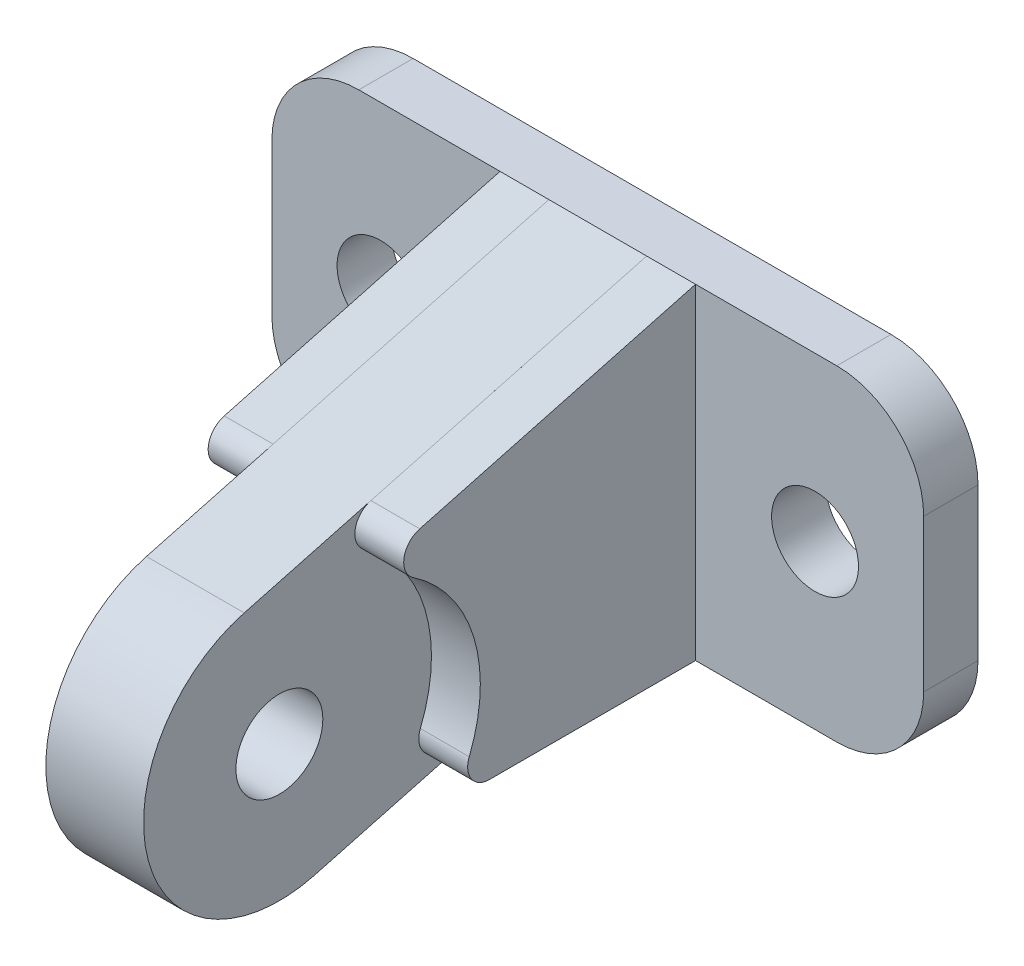
from build123d import *

# Parameters (mm, degrees)
SKETCH1_R                = 4
BOSS_EXTRUDE1_DEPTH      = 5
BOSS_EXTRUDE2_DEPTH      = 9
BOSS_EXTRUDE2_DEPTH_BACK = 9
BOSS_EXTRUDE3_DEPTH      = 4.5
BOSS_EXTRUDE3_DEPTH_BACK = 4.5
SKETCH3_3_R              = 4


with BuildPart() as part:
    # Sketch1 → Boss-Extrude1 (new body)
    with BuildSketch(Plane.XY):
        with BuildLine():
            ThreePointArc((-30, -7), (-27.656854249, -12.656854249), (-22, -15))
            Line((-22, -15), (22, -15))
            ThreePointArc((22, -15), (27.656854249, -12.656854249), (30, -7))
            Line((30, -7), (30, 7))
            ThreePointArc((30, 7), (27.656854249, 12.656854249), (22, 15))
            Line((22, 15), (-22, 15))
            ThreePointArc((-22, 15), (-27.656854249, 12.656854249), (-30, 7))
            Line((-30, 7), (-30, -7))
        make_face()
        with Locations((-20, 0)):
            Circle(SKETCH1_R, mode=Mode.SUBTRACT)
        with Locations((20, 0)):
            Circle(SKETCH1_R, mode=Mode.SUBTRACT)
    extrude(amount=BOSS_EXTRUDE1_DEPTH)

    # Sketch3 → Boss-Extrude2 (add, two sides: drawn at the far end of the back side and taken through both)
    with BuildSketch(Plane(origin=(0, 0, 0), x_dir=(0, 0, -1), z_dir=(1, 0, 0)).offset(-BOSS_EXTRUDE2_DEPTH_BACK)):
        with BuildLine():
            Line((-5, -15), (-5, 15))
            Line((-5, 15), (-30.384833832, 8.198154275))
            ThreePointArc((-30.384833832, 8.198154275), (-31.839798327, 6.596210245), (-30.985266169, 4.608014794))
            ThreePointArc((-30.985266169, 4.608014794), (-25.423013471, -2.908363546), (-25.833411807, -12.25))
            ThreePointArc((-25.833411807, -12.25), (-25.637674581, -14.118033989), (-23.979362186, -15))
            Line((-23.979362186, -15), (-20.371874306, -15))
            Line((-20.371874306, -15), (-5, -15))
        make_face()
    extrude(amount=BOSS_EXTRUDE2_DEPTH + BOSS_EXTRUDE2_DEPTH_BACK)

    # Sketch3<3> → Boss-Extrude3 (add, two sides: drawn at the far end of the back side and taken through both)
    with BuildSketch(Plane(origin=(0, 0, 0), x_dir=(0, 0, -1), z_dir=(1, 0, 0)).offset(-BOSS_EXTRUDE3_DEPTH_BACK)):
        with BuildLine():
            Line((-30.384833832, 8.198154275), (-5, 15))
            Line((-5, 15), (-42.04675827, 5.074136854))
            ThreePointArc((-42.04675827, 5.074136854), (-50.885864002, -10.235118587), (-35.576521096, -19.074072829))
            Line((-35.576521096, -19.074072829), (-20.371874306, -15))
            Line((-20.371874306, -15), (-23.979362186, -15))
            ThreePointArc((-23.979362186, -15), (-25.637674581, -14.118033989), (-25.833411807, -12.25))
            ThreePointArc((-25.833411807, -12.25), (-25.423013471, -2.908363546), (-30.985266169, 4.608014794))
            ThreePointArc((-30.985266169, 4.608014794), (-31.839798327, 6.596210245), (-30.384833832, 8.198154275))
        make_face()
        with Locations((-38.81175916, -7)):
            Circle(SKETCH3_3_R, mode=Mode.SUBTRACT)
    extrude(amount=BOSS_EXTRUDE3_DEPTH + BOSS_EXTRUDE3_DEPTH_BACK)


solid = part.part
